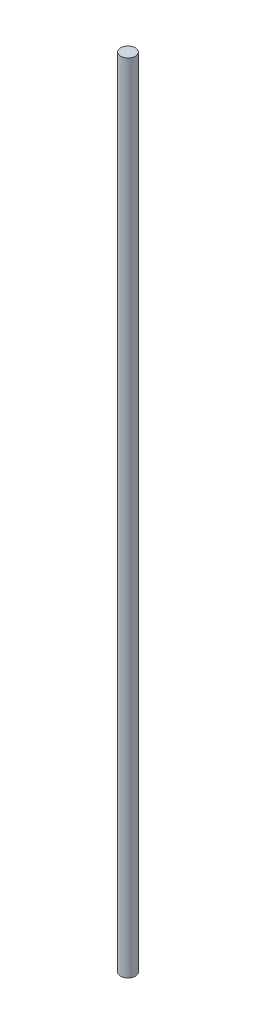
from build123d import *

# Parameters (mm, degrees)
ESQUISSE1_R        = 4
BOSS_EXTRU_1_DEPTH = 433.57044328


with BuildPart() as part:
    # Esquisse1 → Boss.-Extru.1 (new body)
    with BuildSketch(Plane(origin=(0, 0, 0), x_dir=(1, 0, 0), z_dir=(0, 1, 0))):
        with Locations(Location((0, 0, 0), (0, 0, 90))):
            Circle(ESQUISSE1_R)
    extrude(amount=BOSS_EXTRU_1_DEPTH)


solid = part.part
